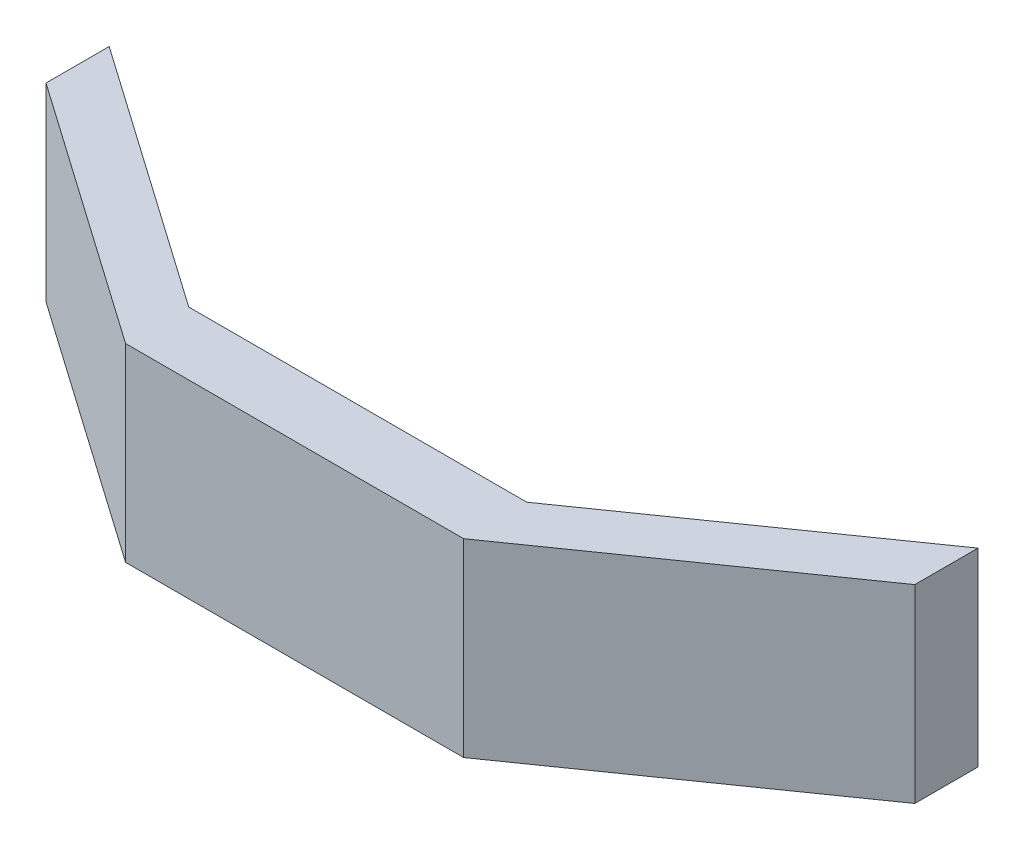
from build123d import *

# Parameters (mm, degrees)
BOSS_EXTRUDE1_DEPTH = 60


with BuildPart() as part:
    # Sketch1 → Boss-Extrude1 (new body)
    with BuildSketch(Plane(origin=(0, 0, 0), x_dir=(1, 0, 0), z_dir=(0, 1, 0))):
        Polygon((-53.5, 10), (-137.496256044, 68.814811664), (-137.496256044, 48.814811664), (-53.5, -10), (53.5, -10), (137.496256044, 48.814811664), (137.496256044, 68.814811664), (53.5, 10), align=None)
    extrude(amount=BOSS_EXTRUDE1_DEPTH)


solid = part.part
